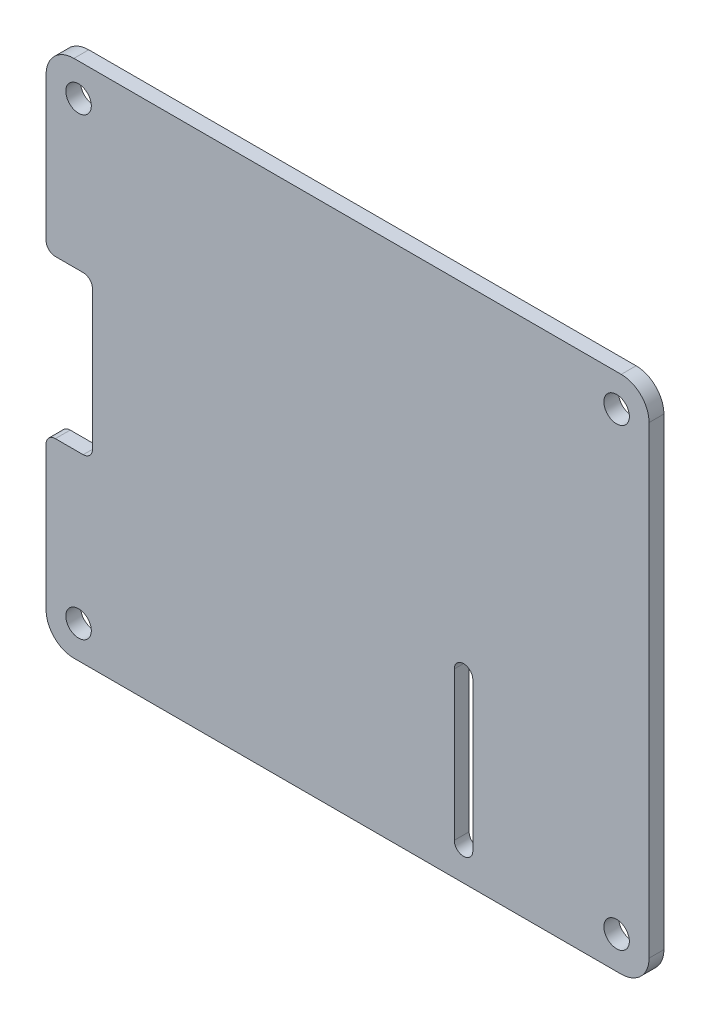
from build123d import *

# Parameters (mm, degrees)
BOSS_EXTRUDE1_DEPTH = 1.6
CUT_EXTRUDE1_DEPTH  = 43.927962915
SKETCH4_R           = 1.375
CUT_EXTRUDE2_DEPTH  = 43.927962915


with BuildPart() as part:
    # Sketch1 → Boss-Extrude1 (new body)
    with BuildSketch(Plane.XY):
        with BuildLine():
            Line((-29.5, -28), (29.5, -28))
            ThreePointArc((29.5, -28), (31.621320344, -27.121320344), (32.5, -25))
            Line((32.5, -25), (32.5, 25))
            ThreePointArc((32.5, 25), (31.621320344, 27.121320344), (29.5, 28))
            Line((29.5, 28), (-29.5, 28))
            ThreePointArc((-29.5, 28), (-31.621320344, 27.121320344), (-32.5, 25))
            Line((-32.5, 25), (-32.5, 9.5))
            ThreePointArc((-32.5, 9.5), (-32.207106781, 8.792893219), (-31.5, 8.5))
            Line((-31.5, 8.5), (-28.5, 8.5))
            ThreePointArc((-28.5, 8.5), (-27.792893219, 8.207106781), (-27.5, 7.5))
            Line((-27.5, 7.5), (-27.5, -7.5))
            ThreePointArc((-27.5, -7.5), (-27.792893219, -8.207106781), (-28.5, -8.5))
            Line((-28.5, -8.5), (-31.5, -8.5))
            ThreePointArc((-31.5, -8.5), (-32.207106781, -8.792893219), (-32.5, -9.5))
            Line((-32.5, -9.5), (-32.5, -25))
            ThreePointArc((-32.5, -25), (-31.621320344, -27.121320344), (-29.5, -28))
        make_face()
    extrude(amount=BOSS_EXTRUDE1_DEPTH)

    # Sketch3 → Cut-Extrude1 (cut, through all)
    with BuildSketch(Plane.XY.offset(1.6)):
        with BuildLine():
            Line((13.5, -8.5), (13.5, -24.5))
            ThreePointArc((13.5, -24.5), (12.5, -25.5), (11.5, -24.5))
            Line((11.5, -24.5), (11.5, -8.5))
            ThreePointArc((11.5, -8.5), (12.5, -7.5), (13.5, -8.5))
        make_face()
    extrude(amount=-CUT_EXTRUDE1_DEPTH, mode=Mode.SUBTRACT)

    # Sketch4 → Cut-Extrude2 (cut, through all)
    with BuildSketch(Plane.XY.offset(1.6)):
        with Locations((-29, 24.5)):
            Circle(SKETCH4_R)
        with Locations((29, 24.5)):
            Circle(SKETCH4_R)
        with Locations(Location((29, -24.5, 0), (0, 0, 180))):
            Circle(SKETCH4_R)
        with Locations(Location((-29, -24.5, 0), (0, 0, 180))):
            Circle(SKETCH4_R)
    extrude(amount=-CUT_EXTRUDE2_DEPTH, mode=Mode.SUBTRACT)


solid = part.part
